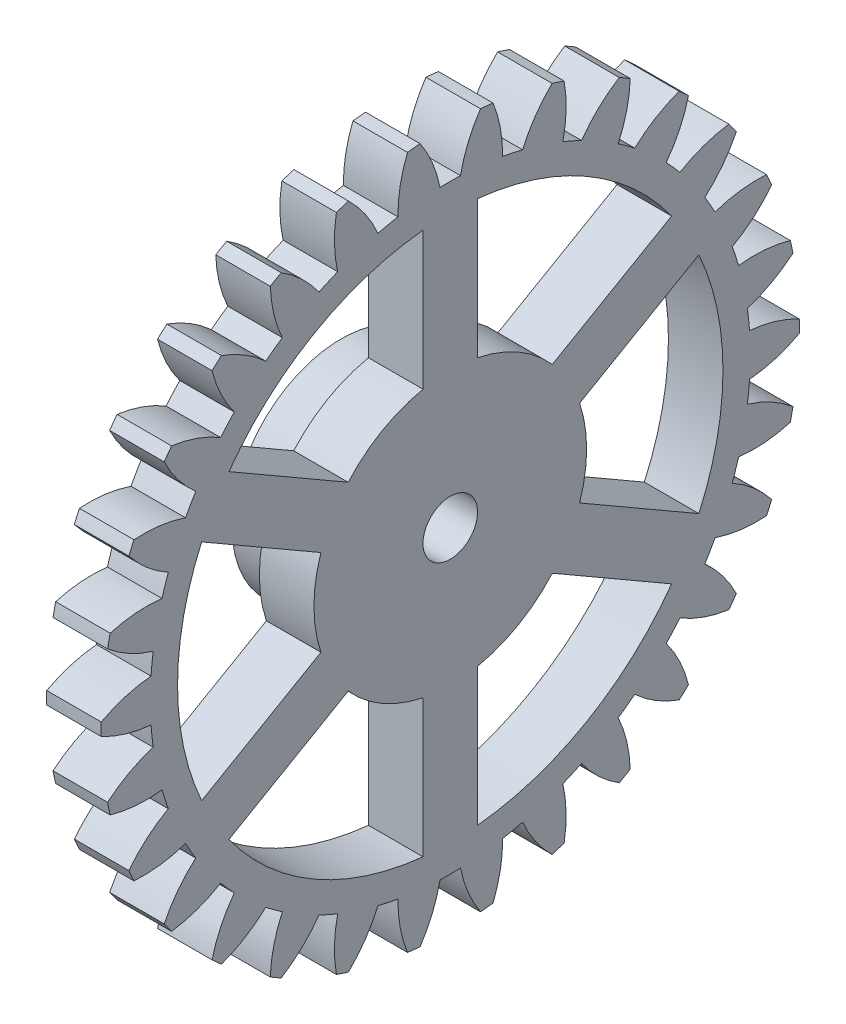
from build123d import *

# Parameters (mm, degrees)
BASPROSKE_W        = 6.35
BASPROSKE_H        = 40.64
TOOTHCUT_DEPTH     = 58.823366384
TEETHCUTS_COUNT    = 30
TEETHCUTS_ANGLE    = 348
HUBNEAONESKE_R     = 12.7
HUBNEARONE_DEPTH   = 6.3500508
BORSKE_R           = 3.175
BORE_DEPTH         = 12.7000508
CUT_EXTRUDE2_DEPTH = 59.754894035
CIRPATTERN1_COUNT  = 6


with BuildPart() as part:
    # BasProSke → Base-Revolve (revolve)
    with BuildSketch(Plane(origin=(0, 0, 0), x_dir=(1, 0, 0), z_dir=(0, 1, 0)), mode=Mode.PRIVATE) as base_revolve_sk:
        with Locations((3.175, 20.32)):
            Rectangle(BASPROSKE_W, BASPROSKE_H)
    revolve(base_revolve_sk.sketch.rotate(Axis((-10, 0, 0), (1, 0, 0)), 180), axis=Axis((-10, 0, 0), (1, 0, 0)))

    # TooCutSke → ToothCut (cut, through all)
    with BuildSketch(Plane(origin=(0, 0, 0), x_dir=(0, 0, -1), z_dir=(1, 0, 0))):
        with BuildLine():
            ThreePointArc((1.193059804, 34.903345476), (0, 34.92373), (-1.193059804, 34.903345476))
            ThreePointArc((-1.193059804, 34.903345476), (-2.08106185, 37.825313582), (-3.533817541, 40.511564901))
            ThreePointArc((-3.533817541, 40.511564901), (0, 40.6654), (3.533817541, 40.511564901))
            ThreePointArc((3.533817541, 40.511564901), (2.08106185, 37.825313582), (1.193059804, 34.903345476))
        make_face()
    toothcut = extrude(amount=TOOTHCUT_DEPTH, mode=Mode.SUBTRACT)

    # TeethCuts: ToothCut ×30 about axis
    teethcuts_axis = Axis((-10, 0, 0), (1, 0, 0))
    for i in range(1, TEETHCUTS_COUNT):
        add(toothcut.rotate(teethcuts_axis, i * TEETHCUTS_ANGLE / (TEETHCUTS_COUNT - 1)), mode=Mode.SUBTRACT)

    # HubNeaOneSke → HubNearOne (add)
    with BuildSketch(Plane.ZY):
        with Locations(Location((0, 0, 0), (0, 0, 180))):
            Circle(HUBNEAONESKE_R)
    extrude(amount=HUBNEARONE_DEPTH)

    # BorSke → Bore (cut, symmetric)
    with BuildSketch(Plane(origin=(0, 0, 0), x_dir=(0, 0, -1), z_dir=(1, 0, 0))):
        with Locations(Location((0, 0, 0), (0, 0, 180))):
            Circle(BORSKE_R)
    extrude(amount=BORE_DEPTH, both=True, mode=Mode.SUBTRACT)

    # Sketch1 → Cut-Extrude2 (cut, through all)
    with BuildSketch(Plane.ZY.offset(6.3500508)):
        with BuildLine():
            ThreePointArc((3.175, 31.58957473), (15.874365, 27.495206718), (25.769874211, 18.544418022))
            Line((25.769874211, 18.544418022), (11.882884182, 10.52676059))
            ThreePointArc((11.882884182, 10.52676059), (7.9375, 13.748153285), (3.175, 15.554259867))
            Line((3.175, 15.554259867), (3.175, 31.58957473))
        make_face()
    cut_extrude2 = extrude(amount=-CUT_EXTRUDE2_DEPTH, mode=Mode.SUBTRACT)

    # CirPattern1: Cut-Extrude2 ×6 about axis
    cirpattern1_axis = Axis((0, 0, 0), (1, 0, 0))
    for i in range(1, CIRPATTERN1_COUNT):
        add(cut_extrude2.rotate(cirpattern1_axis, i * 360 / CIRPATTERN1_COUNT), mode=Mode.SUBTRACT)


solid = part.part
